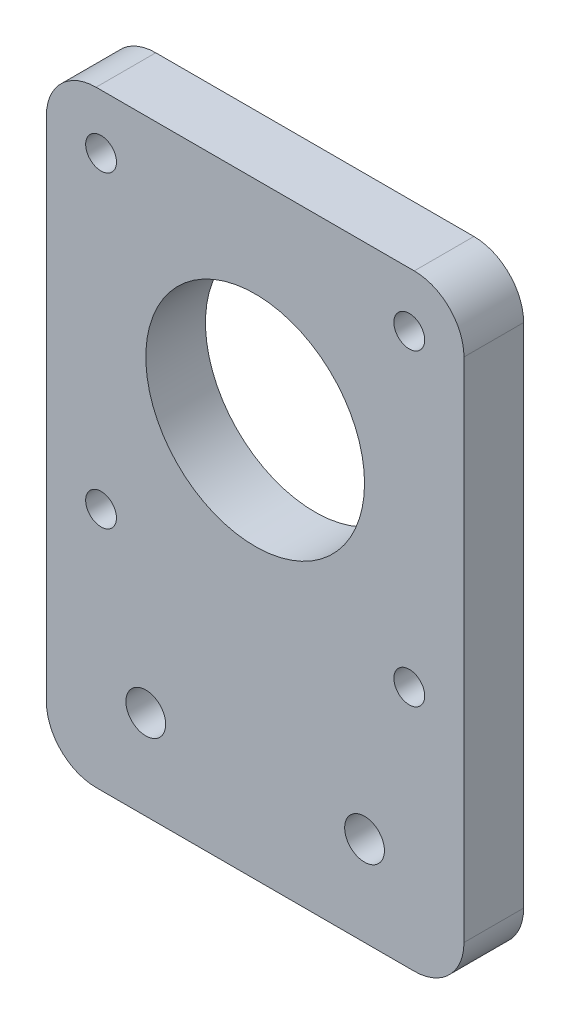
from build123d import *

# Parameters (mm, degrees)
SKETCH1_R           = 11
SKETCH1_R_2         = 1.55
SKETCH1_R_3         = 2
BOSS_EXTRUDE1_DEPTH = 6


with BuildPart() as part:
    # Sketch1 → Boss-Extrude1 (new body)
    with BuildSketch(Plane.XY):
        with BuildLine():
            Line((5, 0), (37, 0))
            ThreePointArc((37, 0), (40.535533906, 1.464466094), (42, 5))
            Line((42, 5), (42, 56))
            ThreePointArc((42, 56), (40.535533906, 59.535533906), (37, 61))
            Line((37, 61), (5, 61))
            ThreePointArc((5, 61), (1.464466094, 59.535533906), (0, 56))
            Line((0, 56), (0, 5))
            ThreePointArc((0, 5), (1.464466094, 1.464466094), (5, 0))
        make_face()
        with Locations((21, 40)):
            Circle(SKETCH1_R, mode=Mode.SUBTRACT)
        with Locations((36.5, 55.5)):
            Circle(SKETCH1_R_2, mode=Mode.SUBTRACT)
        with Locations((5.5, 55.5)):
            Circle(SKETCH1_R_2, mode=Mode.SUBTRACT)
        with Locations((5.5, 24.5)):
            Circle(SKETCH1_R_2, mode=Mode.SUBTRACT)
        with Locations((36.5, 24.5)):
            Circle(SKETCH1_R_2, mode=Mode.SUBTRACT)
        with Locations((10, 9)):
            Circle(SKETCH1_R_3, mode=Mode.SUBTRACT)
        with Locations((32, 9)):
            Circle(SKETCH1_R_3, mode=Mode.SUBTRACT)
    extrude(amount=BOSS_EXTRUDE1_DEPTH)


solid = part.part
